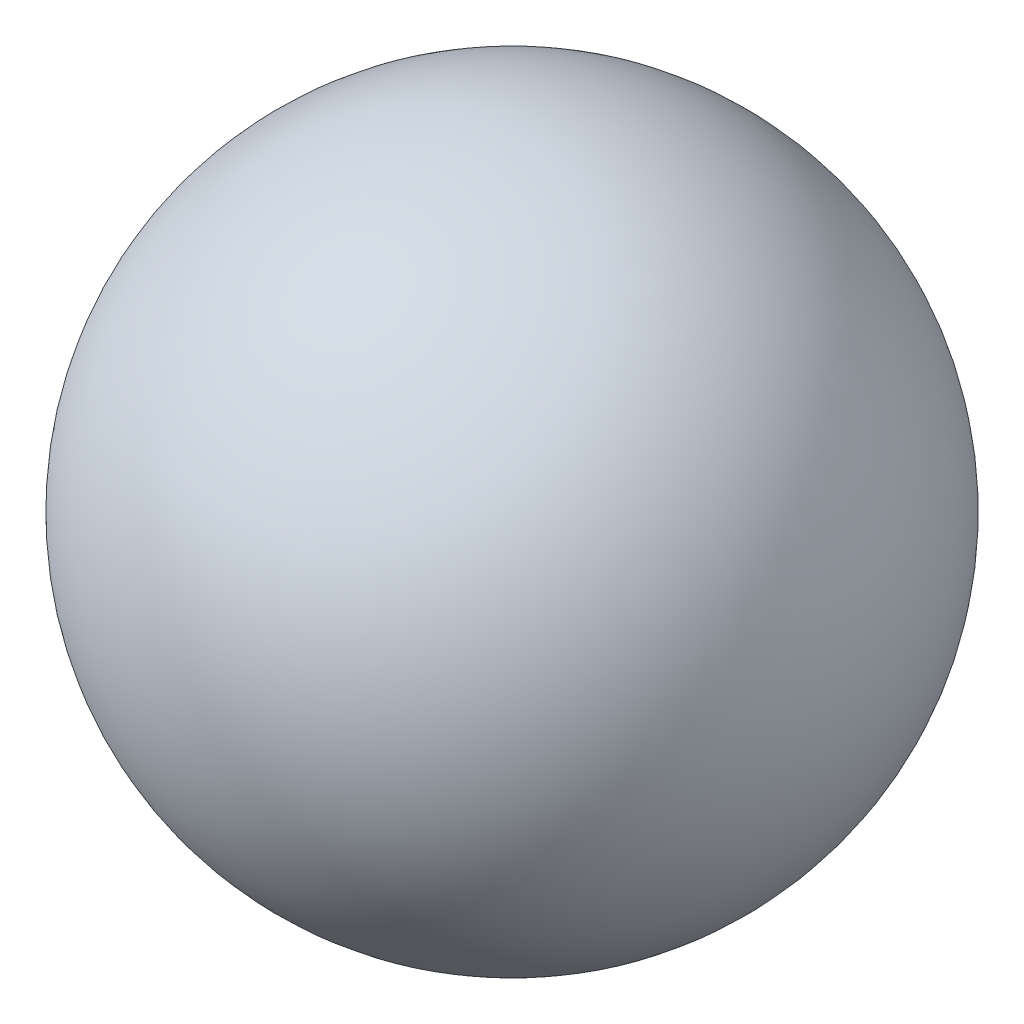
from build123d import *


with BuildPart() as part:
    # Esquisse1 → Révolution2 (revolve)
    with BuildSketch(Plane.XY):
        with BuildLine():
            Line((0, 9), (0, -9))
            ThreePointArc((0, -9), (-9, 0), (0, 9))
        make_face()
    revolve(axis=Axis((0, 11.660556718, 0), (0, -1, 0)))


solid = part.part
